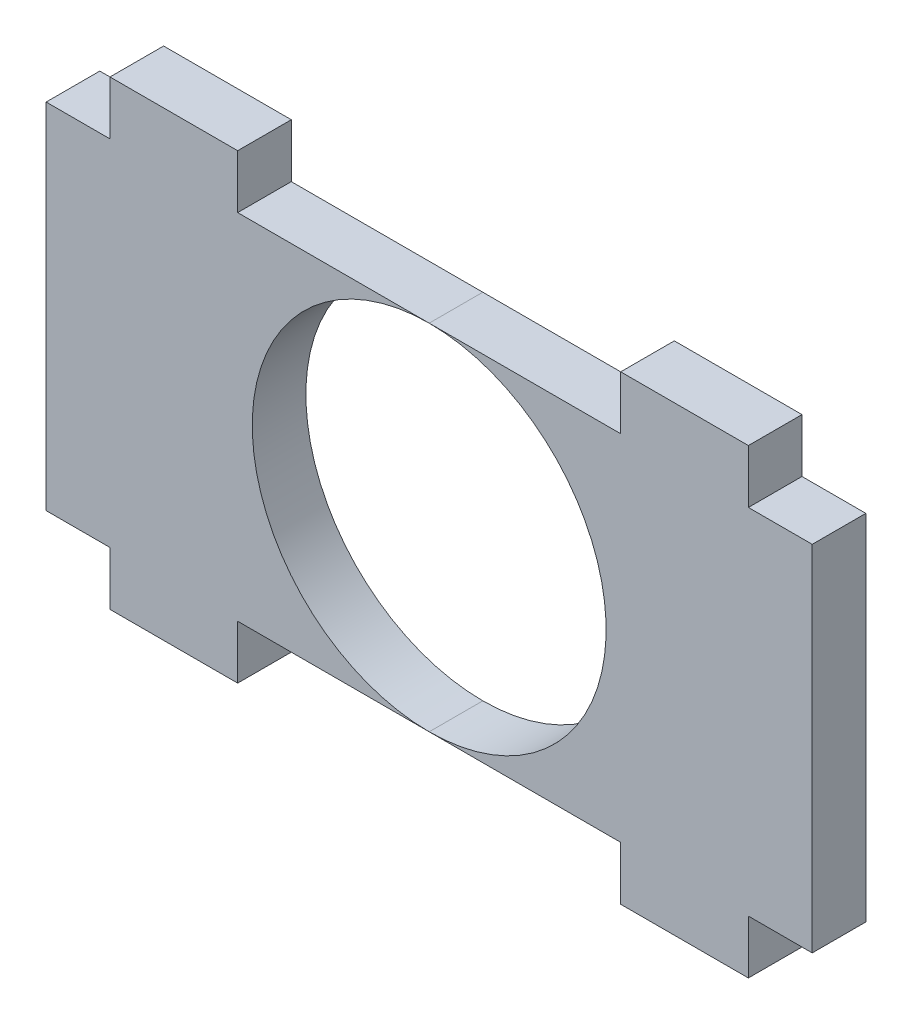
from build123d import *

# Parameters (mm, degrees)
BOSS_EXTRUDE1_DEPTH   = 5.334
BOSS_EXTRUDE1_2_DEPTH = 5.334
SKETCH3_W             = 12.7
SKETCH3_H             = 5.334
BOSS_EXTRUDE2_DEPTH   = 5.334
SKETCH4_W             = 12.7
SKETCH4_H             = 5.334
BOSS_EXTRUDE3_DEPTH   = 5.334


with BuildPart() as part:
    # Sketch1 → Boss-Extrude1 (new body)
    with BuildSketch(Plane.XY):
        with BuildLine():
            Line((-3.2e-08, 17.6), (-38.1, 17.6))
            Line((-38.1, 17.6), (-38.1, -17.6))
            Line((-38.1, -17.6), (0, -17.6))
            ThreePointArc((0, -17.6), (-17.6, -1.6e-08), (-3.2e-08, 17.6))
        make_face()
    extrude(amount=BOSS_EXTRUDE1_DEPTH)



with BuildPart() as body_2:
    # Sketch1 → Boss-Extrude1 2 (new body)
    with BuildSketch(Plane.XY):
        with BuildLine():
            Line((38.1, 17.6), (-3.2e-08, 17.6))
            ThreePointArc((-3.2e-08, 17.6), (17.6, 1.6e-08), (0, -17.6))
            Line((0, -17.6), (38.1, -17.6))
            Line((38.1, -17.6), (38.1, 17.6))
        make_face()
    extrude(amount=BOSS_EXTRUDE1_2_DEPTH)


with BuildPart() as part_1:
    add(part.part)

    add(body_2.part)  # Boss-Extrude2 merges body 2
    # Sketch3 → Boss-Extrude2 (add)
    with BuildSketch(Plane(origin=(0, 17.6, 0), x_dir=(1, 0, 0), z_dir=(0, 1, 0))):
        with Locations((-25.4, -2.667)):
            Rectangle(SKETCH3_W, SKETCH3_H)
        with Locations((25.4, -2.667)):
            Rectangle(SKETCH3_W, SKETCH3_H)
    extrude(amount=BOSS_EXTRUDE2_DEPTH)

    # Sketch4 → Boss-Extrude3 (add)
    with BuildSketch(Plane.XZ.offset(17.6)):
        with Locations((-25.4, 2.667)):
            Rectangle(SKETCH4_W, SKETCH4_H)
        with Locations((25.4, 2.667)):
            Rectangle(SKETCH4_W, SKETCH4_H)
    extrude(amount=BOSS_EXTRUDE3_DEPTH)


solid = part_1.part
